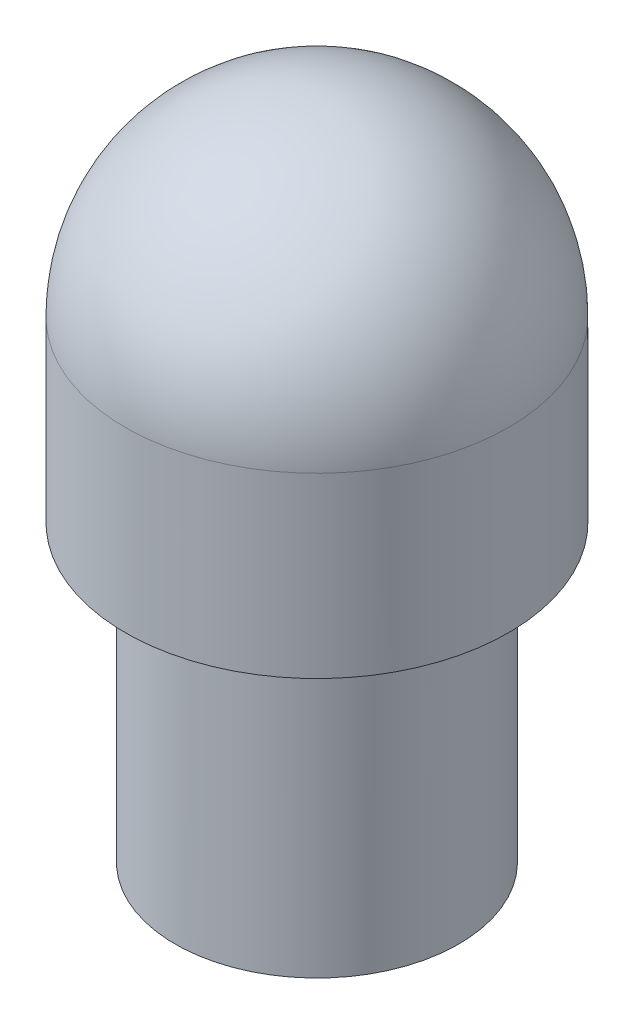
from build123d import *

# Parameters (mm, degrees)
M7X1_0_TAPPED_HOLE1_D     = 6
M7X1_0_TAPPED_HOLE1_DEPTH = 16.002
M7X1_0_TAPPED_HOLE1_TIP   = 1.802581857
SKETCH4_R                 = 3.5
CUT_EXTRUDE1_DEPTH        = 2.5
FILLET1_R                 = 0.762


with BuildPart() as part:
    # Sketch1 → Revolve1 (revolve)
    with BuildSketch(Plane.XY, mode=Mode.PRIVATE) as revolve1_sk:
        with BuildLine():
            Line((-5.2705, 38.3921), (-5.2705, 33.5026))
            Line((-5.2705, 33.5026), (-3.899, 33.5026))
            Line((-3.899, 33.5026), (-3.899, 25.4))
            Line((-3.899, 25.4), (0, 25.4))
            Line((0, 25.4), (0, 43.6626))
            ThreePointArc((0, 43.6626), (-3.72680629, 42.11890629), (-5.2705, 38.3921))
        make_face()
    revolve(revolve1_sk.sketch.rotate(Axis((0, 25.4, 0), (0, 1, 0)), 270), axis=Axis((0, 25.4, 0), (0, 1, 0)))

    # M7x1.0 Tapped Hole1
    with Locations(Plane(origin=(0, 25.4, 0), x_dir=(-1, 0, 0), z_dir=(0, -1, 0))):
        with Locations((0, 0)):
            Hole(M7X1_0_TAPPED_HOLE1_D / 2, depth=M7X1_0_TAPPED_HOLE1_DEPTH)
            with Locations((0, 0, -(M7X1_0_TAPPED_HOLE1_DEPTH + M7X1_0_TAPPED_HOLE1_TIP / 2))):  # 118° drill point
                Cone(0, M7X1_0_TAPPED_HOLE1_D / 2, M7X1_0_TAPPED_HOLE1_TIP, mode=Mode.SUBTRACT)

    # Sketch4 → Cut-Extrude1 (cut)
    with BuildSketch(Plane.XZ.offset(-25.4)):
        with Locations(Location((0, 0, 0), (0, 0, 270))):
            Circle(SKETCH4_R)
    extrude(amount=-CUT_EXTRUDE1_DEPTH, mode=Mode.SUBTRACT)

    # Fillet1
    fillet1_edges = [part.edges().sort_by_distance(p)[0] for p in [
        (0, 33.5026, 3.899),
    ]]
    fillet(fillet1_edges, radius=FILLET1_R)


solid = part.part
